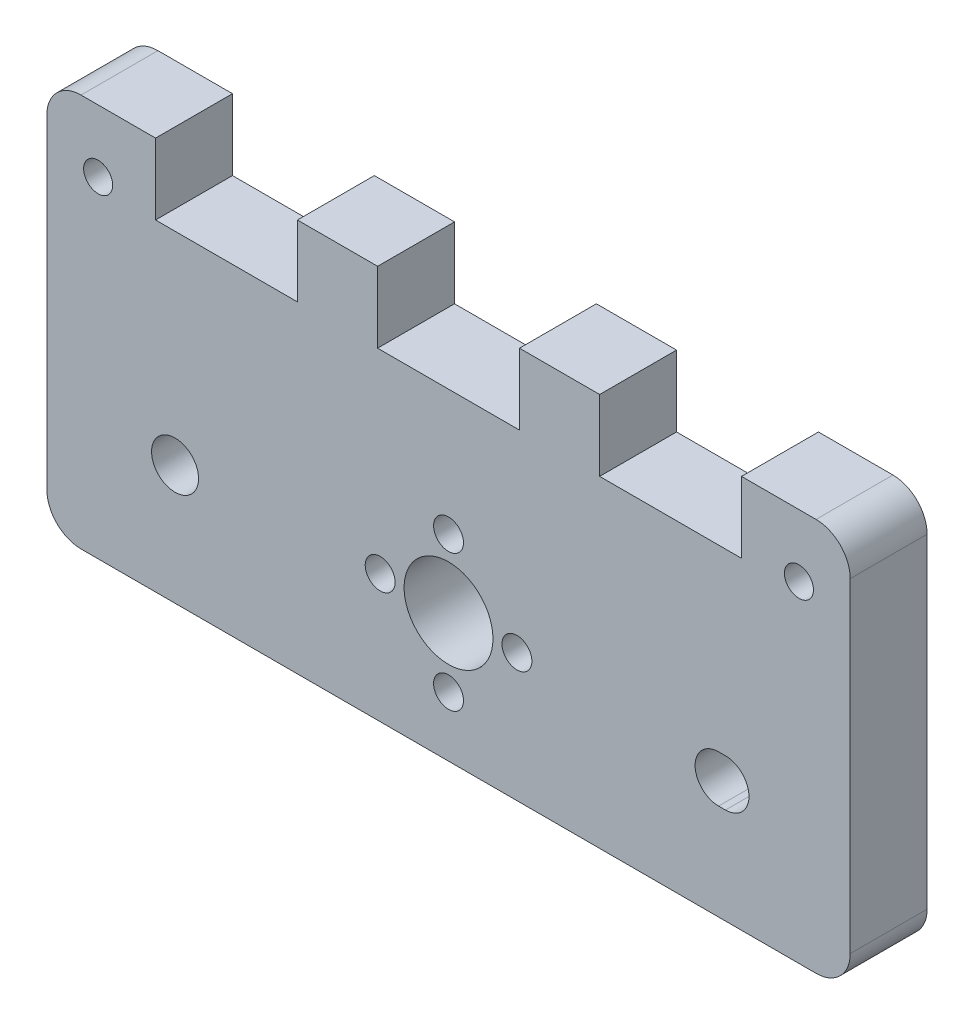
from build123d import *

# Parameters (mm, degrees)
F_01_COMMON_SLIDER_BLANK_DEPTH                 = 9
F_02_START                                     = -0.5
S02_ROUND_LOCATING_GUIDE_AND_RELIEVED_R        = 2.75
F_02_ROUND_LOCATING_GUIDE_AND_RELIEVED_C_DEPTH = 10
F_03_START                                     = -0.5
S03_THREE_DROP_IN_SPRING_SEATS_W               = 16.6
S03_THREE_DROP_IN_SPRING_SEATS_H               = 9.3
F_03_THREE_DROP_IN_SPRING_SEATS_DEPTH          = 10
F_04_START                                     = -0.5
S04_KEEPER_SCREW_HOLES_R                       = 1.7
F_04_KEEPER_SCREW_HOLES_DEPTH                  = 10
F_07_START                                     = -0.15
S07_CLEARANCE_TUNNEL_FOR_ROTATING_SPIN_R       = 5.2
F_07_CLEARANCE_TUNNEL_FOR_ROTATING_SPIND_DEPTH = 109.311915664
SKETCH1_R                                      = 1.75
SKETCH1_R_2                                    = 1.75028584
CUT_EXTRUDE1_DEPTH                             = 10


with BuildPart() as part:
    # S01 - Common slider blank → 01 - Common slider blank (new body)
    with BuildSketch(Plane.XY):
        with BuildLine():
            Line((-43, -97), (43, -97))
            ThreePointArc((43, -97), (45.828427125, -95.828427125), (47, -93))
            Line((47, -93), (47, -55))
            ThreePointArc((47, -55), (45.828427125, -52.171572875), (43, -51))
            Line((43, -51), (-43, -51))
            ThreePointArc((-43, -51), (-45.828427125, -52.171572875), (-47, -55))
            Line((-47, -55), (-47, -93))
            ThreePointArc((-47, -93), (-45.828427125, -95.828427125), (-43, -97))
        make_face()
    extrude(amount=F_01_COMMON_SLIDER_BLANK_DEPTH)

    # S02 - Round locating guide and relieved companion → 02 - Round locating guide and relieved companion (cut)
    with BuildSketch(Plane.XY.offset(F_02_START)):
        with Locations((-32, -83)):
            Circle(S02_ROUND_LOCATING_GUIDE_AND_RELIEVED_R)
        with BuildLine():
            Line((31.6, -80.25), (32.4, -80.25))
            ThreePointArc((32.4, -80.25), (35.15, -83), (32.4, -85.75))
            Line((32.4, -85.75), (31.6, -85.75))
            ThreePointArc((31.6, -85.75), (28.85, -83), (31.6, -80.25))
        make_face()
    extrude(amount=F_02_ROUND_LOCATING_GUIDE_AND_RELIEVED_C_DEPTH, mode=Mode.SUBTRACT)

    # S03 - Three drop-in spring seats → 03 - Three drop-in spring seats (cut)
    with BuildSketch(Plane.XY.offset(F_03_START)):
        with Locations((-25.980762114, -54.65)):
            Rectangle(S03_THREE_DROP_IN_SPRING_SEATS_W, S03_THREE_DROP_IN_SPRING_SEATS_H)
        with Locations((25.980762114, -54.65)):
            Rectangle(S03_THREE_DROP_IN_SPRING_SEATS_W, S03_THREE_DROP_IN_SPRING_SEATS_H)
        with Locations((0, -54.65)):
            Rectangle(S03_THREE_DROP_IN_SPRING_SEATS_W, S03_THREE_DROP_IN_SPRING_SEATS_H)
    extrude(amount=F_03_THREE_DROP_IN_SPRING_SEATS_DEPTH, mode=Mode.SUBTRACT)

    # S04 - Keeper screw holes → 04 - Keeper screw holes (cut)
    with BuildSketch(Plane.XY.offset(F_04_START)):
        with Locations((-41, -58.3)):
            Circle(S04_KEEPER_SCREW_HOLES_R)
        with Locations((41, -58.3)):
            Circle(S04_KEEPER_SCREW_HOLES_R)
    extrude(amount=F_04_KEEPER_SCREW_HOLES_DEPTH, mode=Mode.SUBTRACT)

    # S07 - Clearance tunnel for rotating spindle retainer → 07 - Clearance tunnel for rotating spindle retainer (cut, through all)
    with BuildSketch(Plane.XY.offset(F_07_START)):
        with Locations((0, -82)):
            Circle(S07_CLEARANCE_TUNNEL_FOR_ROTATING_SPIN_R)
    extrude(amount=F_07_CLEARANCE_TUNNEL_FOR_ROTATING_SPIND_DEPTH, mode=Mode.SUBTRACT)

    # Sketch1 → Cut-Extrude1 (cut)
    with BuildSketch(Plane.XY.offset(9)):
        with Locations((8, -82)):
            Circle(SKETCH1_R)
        with Locations((0, -74)):
            Circle(SKETCH1_R)
        with Locations((0, -90)):
            Circle(SKETCH1_R)
        with Locations((-8, -82)):
            Circle(SKETCH1_R_2)
    extrude(amount=-CUT_EXTRUDE1_DEPTH, mode=Mode.SUBTRACT)


solid = part.part
